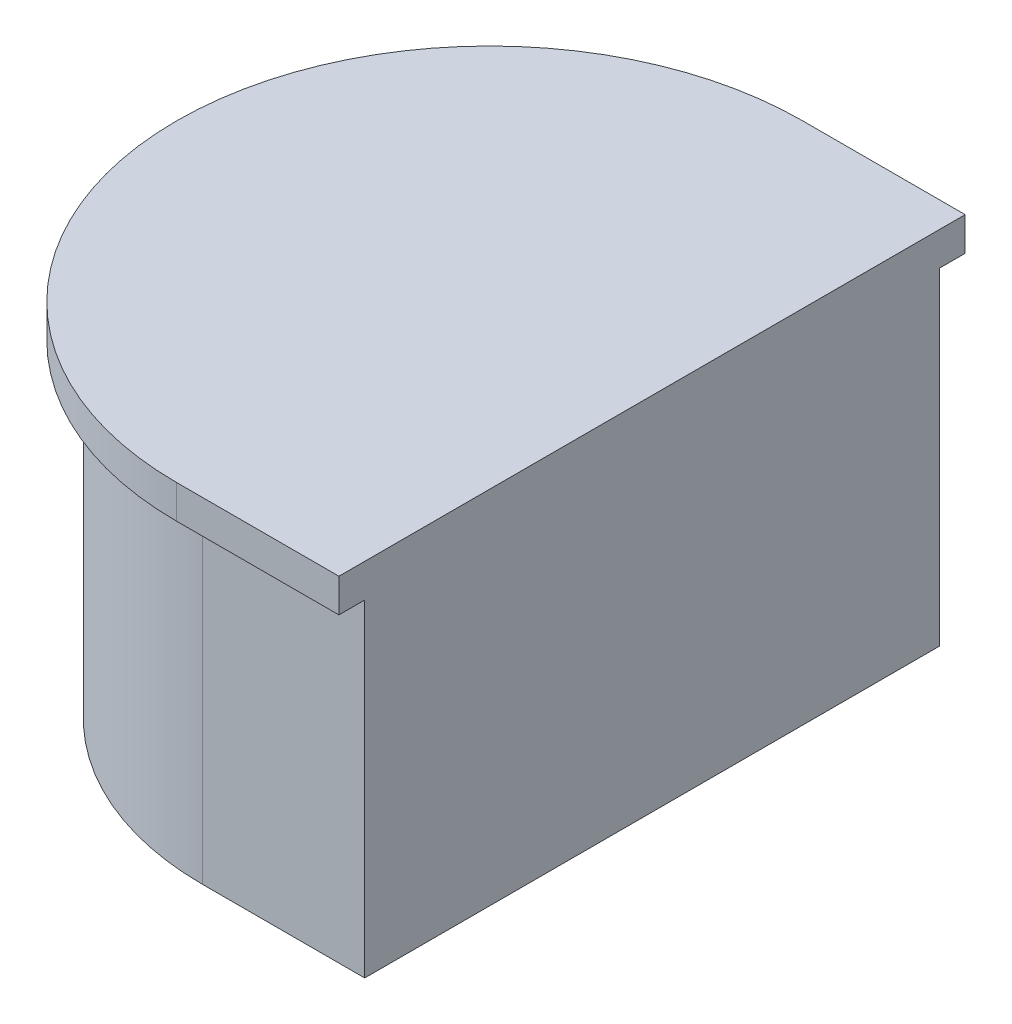
from build123d import *

# Parameters (mm, degrees)
BOSS_EXTRUDE1_DEPTH = 28
BOSS_EXTRUDE2_START = -2.6
BOSS_EXTRUDE2_DEPTH = 2.6


with BuildPart() as part:
    # Sketch1 → Boss-Extrude1 (new body)
    with BuildSketch(Plane(origin=(0, 0, 0), x_dir=(1, 0, 0), z_dir=(0, 1, 0))):
        with BuildLine():
            Line((5.379822255, -23.218858624), (17.981010255, -23.218858624))
            Line((17.981010255, -23.218858624), (17.981010255, 21.376607386))
            Line((17.981010255, 21.376607386), (5.379822255, 21.376607386))
            ThreePointArc((5.379822255, 21.376607386), (-16.91791075, -0.921125619), (5.379822255, -23.218858624))
        make_face()
    extrude(amount=BOSS_EXTRUDE1_DEPTH)

    # Sketch2 → Boss-Extrude2 (add)
    with BuildSketch(Plane(origin=(0, 28, 0), x_dir=(1, 0, 0), z_dir=(0, 1, 0)).offset(BOSS_EXTRUDE2_START)):
        with BuildLine():
            Line((5.379822255, -25.218858624), (17.981010255, -25.218858624))
            Line((17.981010255, -25.218858624), (17.981010255, -23.218858624))
            Line((17.981010255, -23.218858624), (5.379822255, -23.218858624))
            ThreePointArc((5.379822255, -23.218858624), (-16.91791075, -0.921125619), (5.379822255, 21.376607386))
            Line((5.379822255, 21.376607386), (17.981010255, 21.376607386))
            Line((17.981010255, 21.376607386), (17.981010255, 23.376607386))
            Line((17.981010255, 23.376607386), (5.379822255, 23.376607386))
            ThreePointArc((5.379822255, 23.376607386), (-18.91791075, -0.921125619), (5.379822255, -25.218858624))
        make_face()
    extrude(amount=BOSS_EXTRUDE2_DEPTH)


solid = part.part
